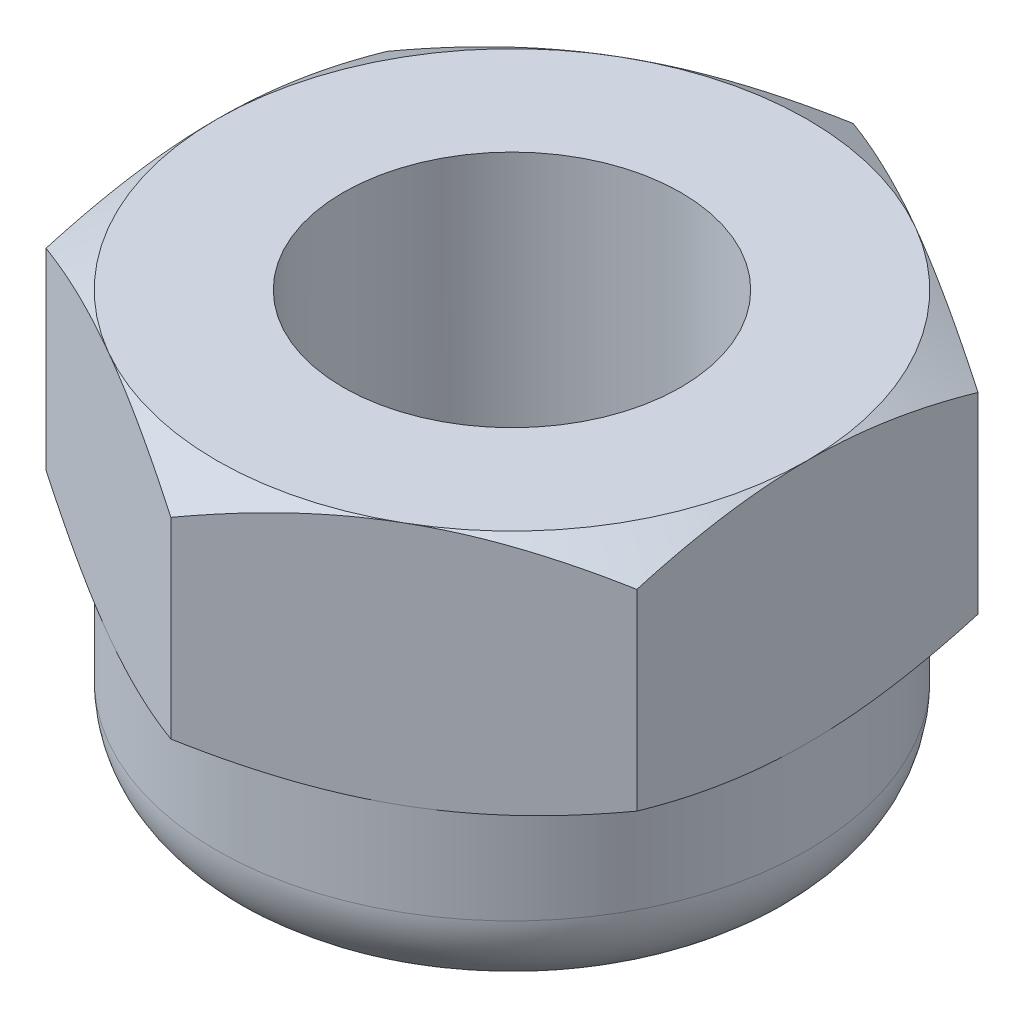
from build123d import *
from build123d.topology import SkipClean

# Parameters (mm, degrees)
SKETCH_1_R      = 2
EXTRUDE_2_DEPTH = 2.9
EXTRUDE_START   = 2.1
SKETCH_3_R      = 3.5
SKETCH_3_R_2    = 2
EXTRUDE_3_DEPTH = 2.1
FILLET_1_R      = 1


with BuildPart() as part:
    # 草图1 → 凸台-拉伸2 (new body)
    with BuildSketch(Plane(origin=(0, 0, 0), x_dir=(1, 0, 0), z_dir=(0, 1, 0))):
        Polygon((3.5, 2.020725942), (0, 4.041451884), (-3.5, 2.020725942), (-3.5, -2.020725942), (0, -4.041451884), (3.5, -2.020725942), align=None)
        with Locations(Location((0, 0, 0), (0, 0, 270))):
            Circle(SKETCH_1_R, mode=Mode.SUBTRACT)
    extrude(amount=EXTRUDE_2_DEPTH)

    # 草图2 → 切除-旋转1 (revolve, cut)
    with BuildSketch(Plane.XY):
        Polygon((6.011473671, 1.45), (3.5, 2.9), (6.011473671, 2.9), align=None)
        Polygon((3.5, 0), (6.011473671, 1.45), (6.011473671, 0), align=None)
    revolve(axis=Axis((0, 1.981363764, 0), (0, 1, 0)), mode=Mode.SUBTRACT)

    # 草图3 → 凸台-拉伸3 (add)
    with SkipClean():  # the faces are left unmerged after this step: merging them gives an invalid solid
        with BuildSketch(Plane.XZ.offset(EXTRUDE_START)):
            with Locations(Location((0, 0, 0), (0, 0, 60))):
                Circle(SKETCH_3_R)
            with Locations(Location((0, 0, 0), (0, 0, 270))):
                Circle(SKETCH_3_R_2, mode=Mode.SUBTRACT)
        extrude(amount=-EXTRUDE_3_DEPTH)

    # 圆角1
    fillet_1_edges = [part.edges().sort_by_distance(p)[0] for p in [
        (-1.75, -2.1, -3.031088913),
    ]]
    fillet(fillet_1_edges, radius=FILLET_1_R)


solid = part.part
